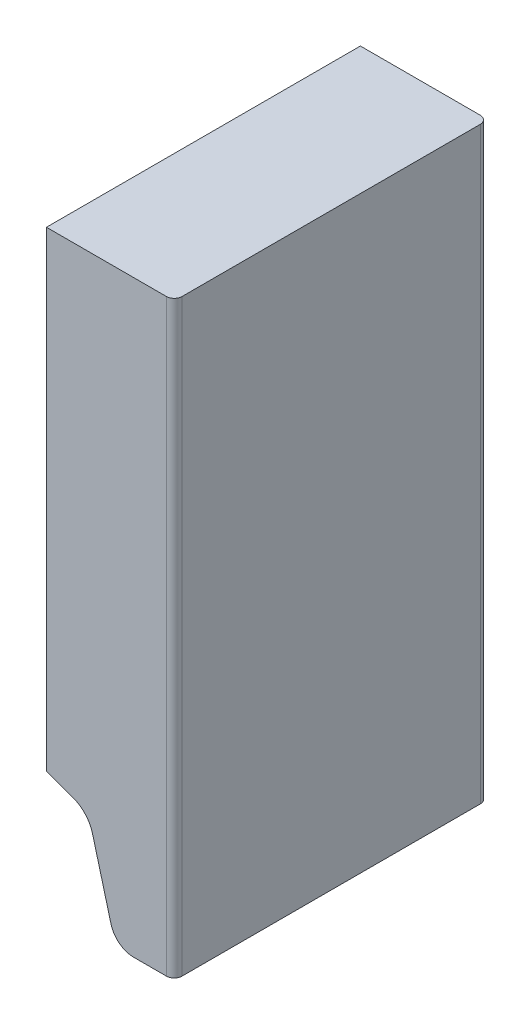
from build123d import *

# Parameters (mm, degrees)
SKETCH1_W           = 16.28
SKETCH1_H           = 40
BOSS_EXTRUDE1_DEPTH = 75
CUT_EXTRUDE1_REACH  = 87.389
FILLET1_R           = 3
FILLET2_R           = 1


with BuildPart() as part:
    # Sketch1 → Boss-Extrude1 (new body)
    with BuildSketch(Plane(origin=(0, 0, 0), x_dir=(1, 0, 0), z_dir=(0, 1, 0))):
        Rectangle(SKETCH1_W, SKETCH1_H)
    extrude(amount=-BOSS_EXTRUDE1_DEPTH)

    # Sketch2 → Cut-Extrude1 (cut, up to next)
    with BuildSketch(Plane.XY.offset(20), mode=Mode.PRIVATE) as cut_extrude1_sk1:
        with BuildLine():
            Line((-4.771919427, -61.241229517), (-8.14, -60.015348442))
            Line((-8.14, -60.015348442), (-8.14, -75))
            Line((-8.14, -75), (0.680596646, -75))
            Line((0.680596646, -75), (-2.276296695, -63.96472382))
            ThreePointArc((-2.276296695, -63.96472382), (-3.190890653, -62.29763917), (-4.771919427, -61.241229517))
        make_face()
    cut_extrude1_tool1 = extrude(cut_extrude1_sk1.sketch, amount=-CUT_EXTRUDE1_REACH, mode=Mode.PRIVATE) & part.part
    add(cut_extrude1_tool1.solids().sort_by_distance((-4.638946, -68.648794, 20))[0], mode=Mode.SUBTRACT)

    # Fillet1
    fillet1_edges = [part.edges().sort_by_distance(p)[0] for p in [
        (0.680596646, -75, 0),
    ]]
    fillet(fillet1_edges, radius=FILLET1_R)

    # Fillet2
    fillet2_edges = [part.edges().sort_by_distance(p)[0] for p in [
        (8.14, -37.5, 20),
        (8.14, -37.5, -20),
    ]]
    fillet(fillet2_edges, radius=FILLET2_R)


solid = part.part
